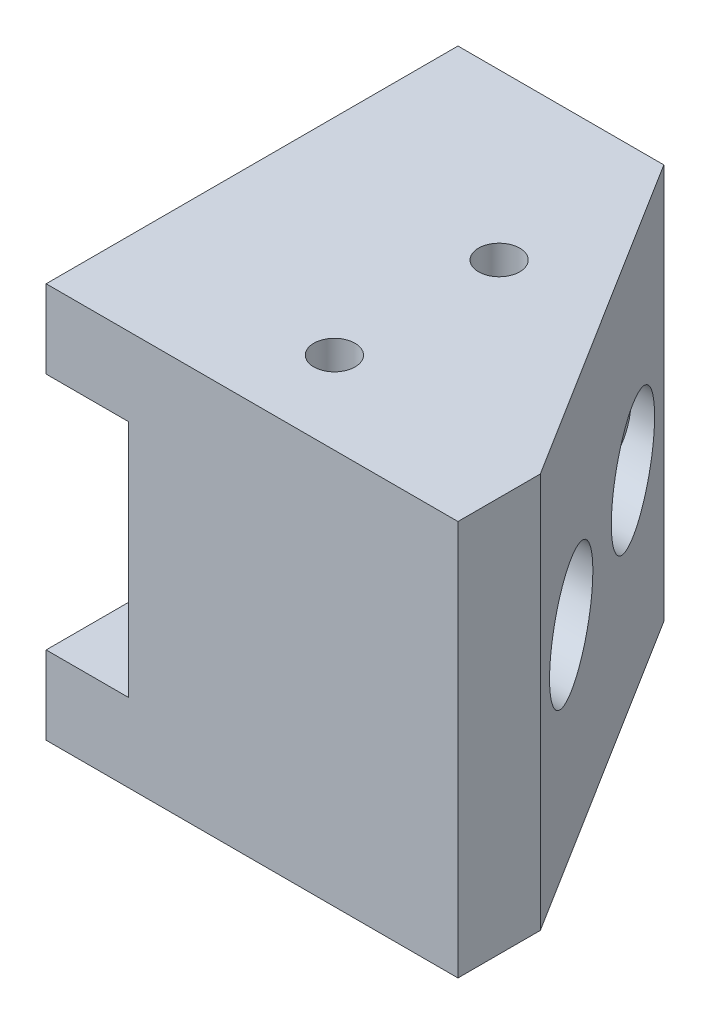
from build123d import *

# Parameters (mm, degrees)
SKETCH_1_W          = 25
SKETCH_1_H          = 24
EXTRUDE_1_DEPTH     = 25
SKETCH_2_W          = 25
SKETCH_2_H          = 14.5
CUT_EXTRUDE_1_DEPTH = 5
SKETCH_3_R          = 1.5
CUT_EXTRUDE_2_DEPTH = 31.417922349
CUT_EXTRUDE_3_DEPTH = 37.84087404
SKETCH_6_R          = 3.5
CUT_EXTRUDE_4_DEPTH = 13
SKETCH_7_R          = 3.5
CUT_EXTRUDE_5_DEPTH = 7
SKETCH_8_R          = 1.25
CUT_EXTRUDE_6_DEPTH = 37.84087404


with BuildPart() as part:
    # 草图1 → 凸台-拉伸1 (new body)
    with BuildSketch(Plane(origin=(0, 0, 0), x_dir=(0, 0, -1), z_dir=(1, 0, 0))):
        Rectangle(SKETCH_1_W, SKETCH_1_H)
    extrude(amount=EXTRUDE_1_DEPTH)

    # 草图2 → 切除-拉伸1 (cut)
    with BuildSketch(Plane.ZY):
        Rectangle(SKETCH_2_W, SKETCH_2_H)
    extrude(amount=-CUT_EXTRUDE_1_DEPTH, mode=Mode.SUBTRACT)

    # 草图3 → 切除-拉伸2 (cut, through all)
    with BuildSketch(Plane(origin=(25, 0, 0), x_dir=(0, 0, -1), z_dir=(1, 0, 0))):
        with Locations((-2.5, 0)):
            Circle(SKETCH_3_R)
        with Locations((7.5, 0)):
            Circle(SKETCH_3_R)
    extrude(amount=-CUT_EXTRUDE_2_DEPTH, mode=Mode.SUBTRACT)

    # 草图5 → 切除-拉伸3 (cut, through all)
    with BuildSketch(Plane(origin=(0, 12, 0), x_dir=(1, 0, 0), z_dir=(0, 1, 0))):
        Polygon((12.5, 12.5), (25, -7.5), (25, 12.5), align=None)
    extrude(amount=-CUT_EXTRUDE_3_DEPTH, mode=Mode.SUBTRACT)

    # 草图6 → 切除-拉伸4 (cut)
    with BuildSketch(Plane(origin=(25, 0, 0), x_dir=(0, 0, -1), z_dir=(1, 0, 0))):
        with Locations((7.5, 0)):
            Circle(SKETCH_6_R)
    extrude(amount=-CUT_EXTRUDE_4_DEPTH, mode=Mode.SUBTRACT)

    # 草图7 → 切除-拉伸5 (cut)
    with BuildSketch(Plane(origin=(25, 0, 0), x_dir=(0, 0, -1), z_dir=(1, 0, 0))):
        with Locations((-2.5, 0)):
            Circle(SKETCH_7_R)
    extrude(amount=-CUT_EXTRUDE_5_DEPTH, mode=Mode.SUBTRACT)

    # 草图8 → 切除-拉伸6 (cut, through all)
    with BuildSketch(Plane(origin=(0, 12, 0), x_dir=(1, 0, 0), z_dir=(0, 1, 0))):
        with Locations(Location((12.5, 2.5, 0), (0, 0, 270))):
            Circle(SKETCH_8_R)
        with Locations(Location((12.5, -7.5, 0), (0, 0, 270))):
            Circle(SKETCH_8_R)
    extrude(amount=-CUT_EXTRUDE_6_DEPTH, mode=Mode.SUBTRACT)


solid = part.part
